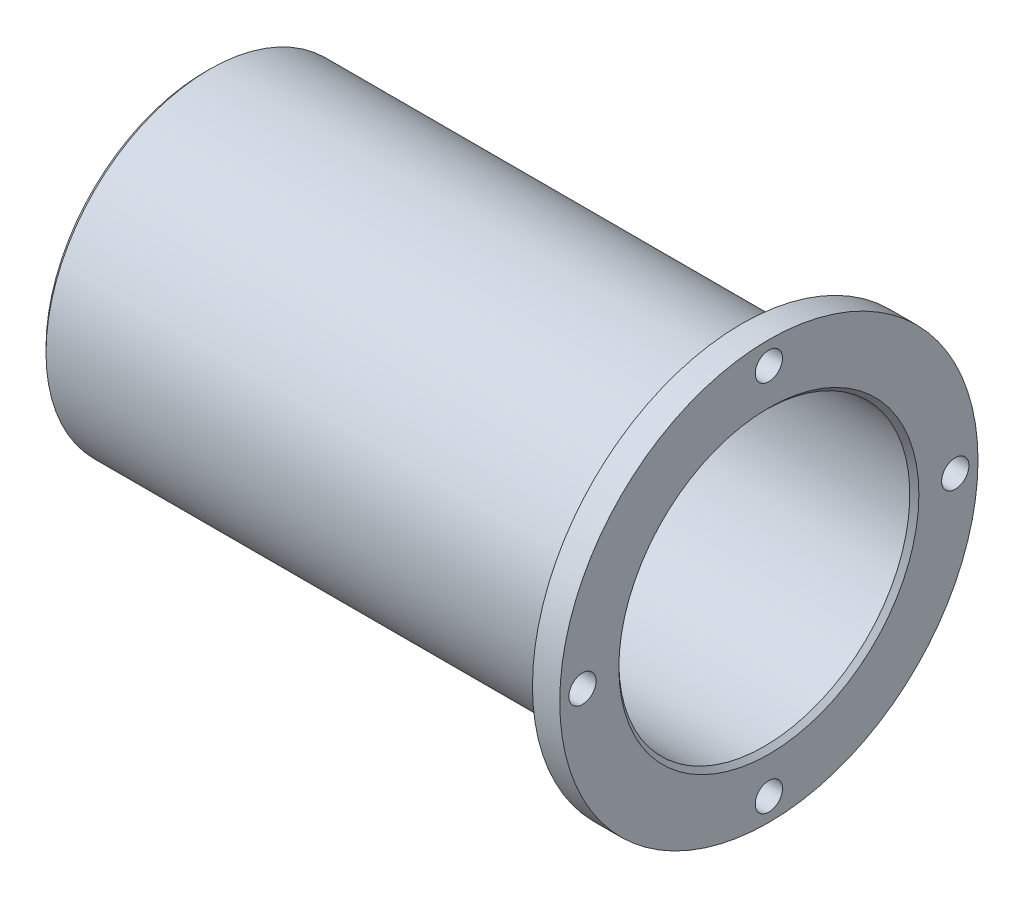
from build123d import *

# Parameters (mm, degrees)
CUT_EXTRUDE_1_REACH = 72.014
SKETCH_2_R          = 1.5
CHAMFER_1_SIZE      = 1.5
CUT_EXTRUDE_2_REACH = 72.014
SKETCH_3_R          = 1.5
CHAMFER_2_SIZE      = 0.5


with BuildPart() as part:
    # 草图1 → 旋转1 (revolve)
    with BuildSketch(Plane.XY, mode=Mode.PRIVATE) as revolve_1_sk:
        Polygon((-62, 18), (-62, 9.5), (-60, 9.5), (-60, 16), (0, 16), (0, 23), (-3, 23), (-3, 18), align=None)
    revolve(revolve_1_sk.sketch.rotate(Axis((-69.956231489, 0, 0), (1, 0, 0)), 90), axis=Axis((-69.956231489, 0, 0), (1, 0, 0)))

    # 草图2 → 切除-拉伸1 (cut, up to next)
    with BuildSketch(Plane.ZY.offset(62), mode=Mode.PRIVATE) as cut_extrude_1_sk1:
        with Locations((0, 13)):
            Circle(SKETCH_2_R)
    cut_extrude_1_tool1 = extrude(cut_extrude_1_sk1.sketch, amount=-CUT_EXTRUDE_1_REACH, mode=Mode.PRIVATE) & part.part
    # 草图2 → 切除-拉伸1 (cut, up to next)
    with BuildSketch(Plane.ZY.offset(62), mode=Mode.PRIVATE) as cut_extrude_1_sk2:
        with Locations((13, 0)):
            Circle(SKETCH_2_R)
    cut_extrude_1_tool2 = extrude(cut_extrude_1_sk2.sketch, amount=-CUT_EXTRUDE_1_REACH, mode=Mode.PRIVATE) & part.part
    # 草图2 → 切除-拉伸1 (cut, up to next)
    with BuildSketch(Plane.ZY.offset(62), mode=Mode.PRIVATE) as cut_extrude_1_sk3:
        with Locations((0, -13)):
            Circle(SKETCH_2_R)
    cut_extrude_1_tool3 = extrude(cut_extrude_1_sk3.sketch, amount=-CUT_EXTRUDE_1_REACH, mode=Mode.PRIVATE) & part.part
    # 草图2 → 切除-拉伸1 (cut, up to next)
    with BuildSketch(Plane.ZY.offset(62), mode=Mode.PRIVATE) as cut_extrude_1_sk4:
        with Locations((-13, 0)):
            Circle(SKETCH_2_R)
    cut_extrude_1_tool4 = extrude(cut_extrude_1_sk4.sketch, amount=-CUT_EXTRUDE_1_REACH, mode=Mode.PRIVATE) & part.part
    add(cut_extrude_1_tool1.solids().sort_by_distance((-62, 13, 0))[0], mode=Mode.SUBTRACT)
    add(cut_extrude_1_tool2.solids().sort_by_distance((-62, 0, 13))[0], mode=Mode.SUBTRACT)
    add(cut_extrude_1_tool3.solids().sort_by_distance((-62, -13, 0))[0], mode=Mode.SUBTRACT)
    add(cut_extrude_1_tool4.solids().sort_by_distance((-62, 0, -13))[0], mode=Mode.SUBTRACT)

    # 倒角1
    chamfer_1_edges = [part.edges().sort_by_distance(p)[0] for p in [
        (-62, 13, -1.5),
        (-62, 0, 11.5),
        (-62, -13, -1.5),
        (-62, 0, -14.5),
    ]]
    chamfer(chamfer_1_edges, length=CHAMFER_1_SIZE)

    # 草图3 → 切除-拉伸2 (cut, up to next)
    with BuildSketch(Plane(origin=(0, 0, 0), x_dir=(0, 0, -1), z_dir=(1, 0, 0)), mode=Mode.PRIVATE) as cut_extrude_2_sk1:
        with Locations((0, 20.5)):
            Circle(SKETCH_3_R)
    cut_extrude_2_tool1 = extrude(cut_extrude_2_sk1.sketch, amount=-CUT_EXTRUDE_2_REACH, mode=Mode.PRIVATE) & part.part
    # 草图3 → 切除-拉伸2 (cut, up to next)
    with BuildSketch(Plane(origin=(0, 0, 0), x_dir=(0, 0, -1), z_dir=(1, 0, 0)), mode=Mode.PRIVATE) as cut_extrude_2_sk2:
        with Locations((20.5, 0)):
            Circle(SKETCH_3_R)
    cut_extrude_2_tool2 = extrude(cut_extrude_2_sk2.sketch, amount=-CUT_EXTRUDE_2_REACH, mode=Mode.PRIVATE) & part.part
    # 草图3 → 切除-拉伸2 (cut, up to next)
    with BuildSketch(Plane(origin=(0, 0, 0), x_dir=(0, 0, -1), z_dir=(1, 0, 0)), mode=Mode.PRIVATE) as cut_extrude_2_sk3:
        with Locations((0, -20.5)):
            Circle(SKETCH_3_R)
    cut_extrude_2_tool3 = extrude(cut_extrude_2_sk3.sketch, amount=-CUT_EXTRUDE_2_REACH, mode=Mode.PRIVATE) & part.part
    # 草图3 → 切除-拉伸2 (cut, up to next)
    with BuildSketch(Plane(origin=(0, 0, 0), x_dir=(0, 0, -1), z_dir=(1, 0, 0)), mode=Mode.PRIVATE) as cut_extrude_2_sk4:
        with Locations((-20.5, 0)):
            Circle(SKETCH_3_R)
    cut_extrude_2_tool4 = extrude(cut_extrude_2_sk4.sketch, amount=-CUT_EXTRUDE_2_REACH, mode=Mode.PRIVATE) & part.part
    add(cut_extrude_2_tool1.solids().sort_by_distance((0, 20.5, 0))[0], mode=Mode.SUBTRACT)
    add(cut_extrude_2_tool2.solids().sort_by_distance((0, 0, -20.5))[0], mode=Mode.SUBTRACT)
    add(cut_extrude_2_tool3.solids().sort_by_distance((0, -20.5, 0))[0], mode=Mode.SUBTRACT)
    add(cut_extrude_2_tool4.solids().sort_by_distance((0, 0, 20.5))[0], mode=Mode.SUBTRACT)

    # 倒角2
    chamfer_2_edges = [part.edges().sort_by_distance(p)[0] for p in [
        (0, 0, -16),
        (-62, 0, -18),
    ]]
    chamfer(chamfer_2_edges, length=CHAMFER_2_SIZE)


solid = part.part
